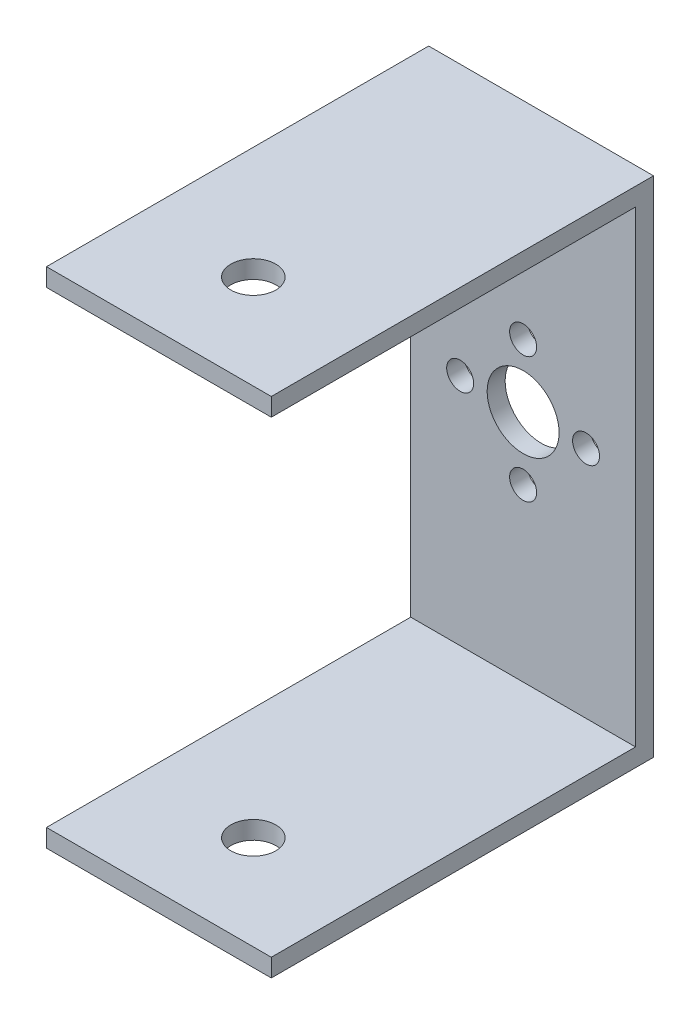
from build123d import *

# Parameters (mm, degrees)
SKETCH1_W           = 25
SKETCH1_H           = 52
BOSS_EXTRUDE1_DEPTH = 2
SKETCH2_W           = 25
SKETCH2_H           = 42.5
BOSS_EXTRUDE2_DEPTH = 2
SKETCH3_W           = 25
SKETCH3_H           = 42.5
BOSS_EXTRUDE3_DEPTH = 2
SKETCH4_R           = 2.5
CUT_EXTRUDE1_DEPTH  = 70
SKETCH5_R           = 4
CUT_EXTRUDE2_DEPTH  = 21
SKETCH6_R           = 1.5
CUT_EXTRUDE3_DEPTH  = 21


with BuildPart() as part:
    # Sketch1 → Boss-Extrude1 (new body)
    with BuildSketch(Plane.XY):
        with Locations((-0.174770451, 4.502942624)):
            Rectangle(SKETCH1_W, SKETCH1_H)
    extrude(amount=BOSS_EXTRUDE1_DEPTH)

    # Sketch2 → Boss-Extrude2 (add)
    with BuildSketch(Plane(origin=(0, 30.502942624, 0), x_dir=(1, 0, 0), z_dir=(0, 1, 0))):
        with Locations((-0.174770451, -21.25)):
            Rectangle(SKETCH2_W, SKETCH2_H)
    extrude(amount=BOSS_EXTRUDE2_DEPTH)

    # Sketch3 → Boss-Extrude3 (add)
    with BuildSketch(Plane(origin=(0, -21.497057376, 0), x_dir=(-1, 0, 0), z_dir=(0, -1, 0))):
        with Locations((0.174770451, -21.25)):
            Rectangle(SKETCH3_W, SKETCH3_H)
    extrude(amount=BOSS_EXTRUDE3_DEPTH)

    # Sketch4 → Cut-Extrude1 (cut)
    with BuildSketch(Plane(origin=(0, 32.502942624, 0), x_dir=(1, 0, 0), z_dir=(0, 1, 0))):
        with Locations(Location((-0.174770451, -32, 0), (0, 0, 90))):
            Circle(SKETCH4_R)
    extrude(amount=-CUT_EXTRUDE1_DEPTH, mode=Mode.SUBTRACT)

    # Sketch5 → Cut-Extrude2 (cut)
    with BuildSketch(Plane(origin=(0, 0, 0), x_dir=(-1, 0, 0), z_dir=(0, 0, -1))):
        with Locations((0.174770451, 4.502942624)):
            Circle(SKETCH5_R)
    extrude(amount=-CUT_EXTRUDE2_DEPTH, mode=Mode.SUBTRACT)

    # Sketch6 → Cut-Extrude3 (cut)
    with BuildSketch(Plane(origin=(0, 0, 0), x_dir=(-1, 0, 0), z_dir=(0, 0, -1))):
        with Locations((7.174770451, 4.502942624)):
            Circle(SKETCH6_R)
        with Locations((0.174770451, -2.497057376)):
            Circle(SKETCH6_R)
        with Locations((-6.825229549, 4.502942624)):
            Circle(SKETCH6_R)
        with Locations((0.174770451, 11.502942624)):
            Circle(SKETCH6_R)
    extrude(amount=-CUT_EXTRUDE3_DEPTH, mode=Mode.SUBTRACT)


solid = part.part
